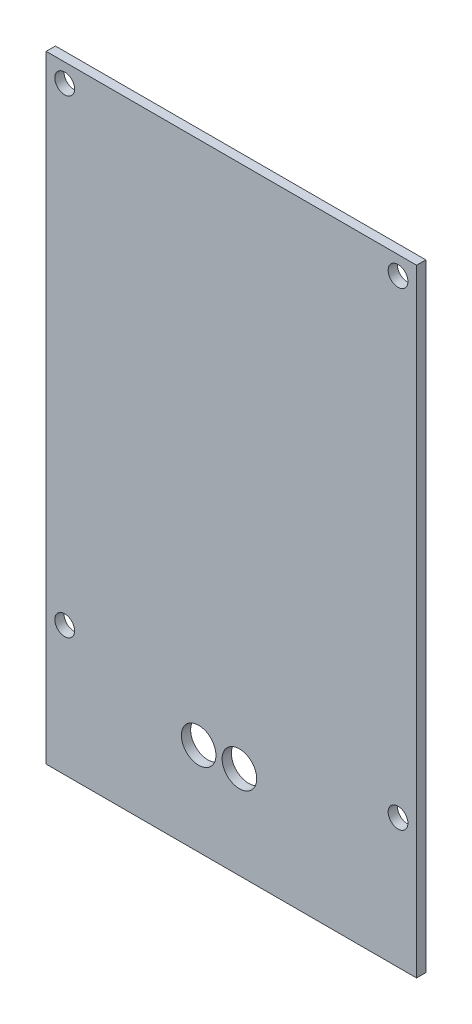
from build123d import *

# Parameters (mm, degrees)
SKETCH1_W           = 60
SKETCH1_H           = 100
SKETCH1_R           = 2.8
SKETCH1_R_2         = 1.6
BOSS_EXTRUDE1_DEPTH = 1.5


with BuildPart() as part:
    # Sketch1 → Boss-Extrude1 (new body)
    with BuildSketch(Plane.XY):
        with Locations((0, 28.447020954)):
            Rectangle(SKETCH1_W, SKETCH1_H)
        with Locations((-5.3, -6.552979046)):
            Circle(SKETCH1_R, mode=Mode.SUBTRACT)
        with Locations((-27, -0.552979046)):
            Circle(SKETCH1_R_2, mode=Mode.SUBTRACT)
        with Locations((27, 75.447020954)):
            Circle(SKETCH1_R_2, mode=Mode.SUBTRACT)
        with Locations((-27, 75.447020954)):
            Circle(SKETCH1_R_2, mode=Mode.SUBTRACT)
        with Locations((27, -0.552979046)):
            Circle(SKETCH1_R_2, mode=Mode.SUBTRACT)
        with Locations((1.3, -6.552979046)):
            Circle(SKETCH1_R, mode=Mode.SUBTRACT)
    extrude(amount=BOSS_EXTRUDE1_DEPTH)


solid = part.part
